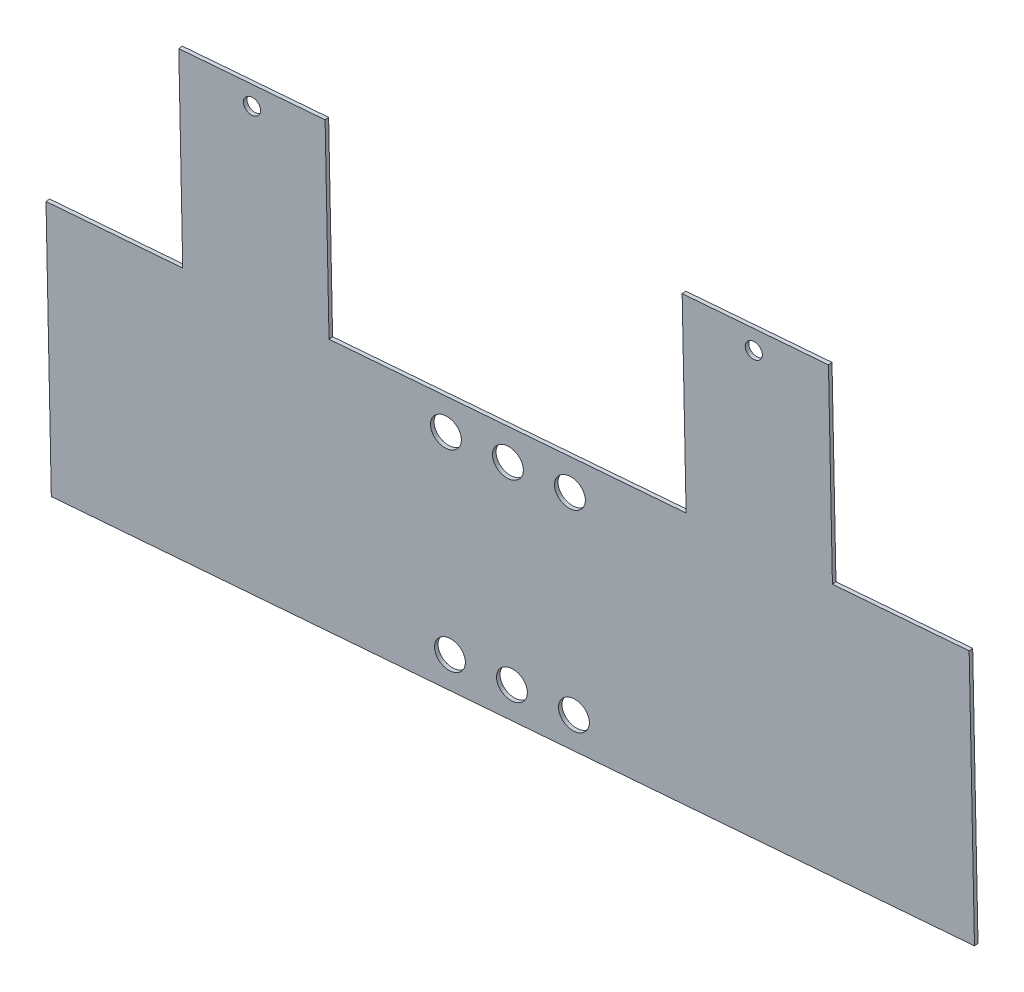
from build123d import *

# Parameters (mm, degrees)
BOSS_EXTRUDE1_DEPTH = 0.6096
SKETCH5_R           = 2.25
CUT_EXTRUDE2_DEPTH  = 0.6096
SKETCH6_R           = 1.25
CUT_EXTRUDE5_DEPTH  = 0.6096
SKETCH7_R           = 1.25
CUT_EXTRUDE6_DEPTH  = 0.6096


with BuildPart() as part:
    # Sketch1 → Boss-Extrude1 (new body)
    with BuildSketch(Plane(origin=(16.997226787, -4.149929847, 204.631375634), x_dir=(0.9965694099183702, 0.001959509651517015, -0.0827379691367708), z_dir=(-0.08276069418699705, 0.020206300667429115, -0.9963645783100802))):
        Polygon((-405.631572024, 283.216979703), (-385.692572024, 283.216979703), (-385.692572024, 323.856979703), (-405.014358213, 323.856979703), (-432.414358217, 323.856979703), (-445.097076418, 323.856979703), (-465.359895626, 323.856979703), (-479.498480719, 323.856979703), (-500.373572024, 323.856979703), (-520.312572024, 323.856979703), (-520.312572024, 283.216979703), (-500.373572024, 283.216979703), (-500.373572024, 253.001628811), (-479.037572024, 253.001628811), (-479.037572024, 283.216979703), (-426.967572024, 283.216979703), (-426.967572024, 253.001628811), (-405.631572024, 253.001628811), align=None)
    extrude(amount=BOSS_EXTRUDE1_DEPTH)

    # Sketch5 → Cut-Extrude2 (cut)
    with BuildSketch(Plane(origin=(16.946775868, -4.137612086, 204.023991787), x_dir=(-0.9965694494101686, -0.0016780440853142462, 0.08274368054637984), z_dir=(-0.08276069418699684, 0.02020630066742907, -0.9963645783100801))):
        with Locations(Location((461.99617795, -318.987055127, 0), (0, 0, 0.096164523))):
            Circle(SKETCH5_R)
        with Locations(Location((452.956635294, -318.984510283, 0), (0, 0, 0.096164523))):
            Circle(SKETCH5_R)
        with Locations(Location((443.917092638, -318.981965439, 0), (0, 0, 0.096164523))):
            Circle(SKETCH5_R)
    cut_extrude2 = extrude(amount=-CUT_EXTRUDE2_DEPTH, mode=Mode.SUBTRACT)

    # Mirror1: Cut-Extrude2 across plane
    add(cut_extrude2.mirror(Plane(origin=(0.085159645, -303.474424262, -6.16154314), x_dir=(5.696257509045297e-06, -0.020299150712569557, 0.9997939509958544), z_dir=(0.00028055772663936035, -0.9997939116314237, -0.020299151511798782))), mode=Mode.SUBTRACT)

    # Sketch6 → Cut-Extrude5 (cut)
    with BuildSketch(Plane(origin=(16.946775868, -4.137612086, 204.023991787), x_dir=(-0.9965694494101686, -0.0016780440853142462, 0.08274368054637984), z_dir=(-0.08276069418699684, 0.020206300667429063, -0.9963645783100801))):
        with Locations(Location((416.50680125, -256.173836565, 0), (0, 0, 0.096164523))):
            Circle(SKETCH6_R)
    extrude(amount=-CUT_EXTRUDE5_DEPTH, mode=Mode.SUBTRACT)

    # Sketch7 → Cut-Extrude6 (cut)
    with BuildSketch(Plane(origin=(16.946775868, -4.137612086, 204.023991787), x_dir=(-0.9965694494101686, -0.001678044085314246, 0.08274368054637983), z_dir=(-0.08276069418699684, 0.020206300667429074, -0.9963645783100802))):
        with Locations(Location((489.681466673, -256.194436956, 0), (0, 0, 0.096164523))):
            Circle(SKETCH7_R)
    extrude(amount=-CUT_EXTRUDE6_DEPTH, mode=Mode.SUBTRACT)


solid = part.part
